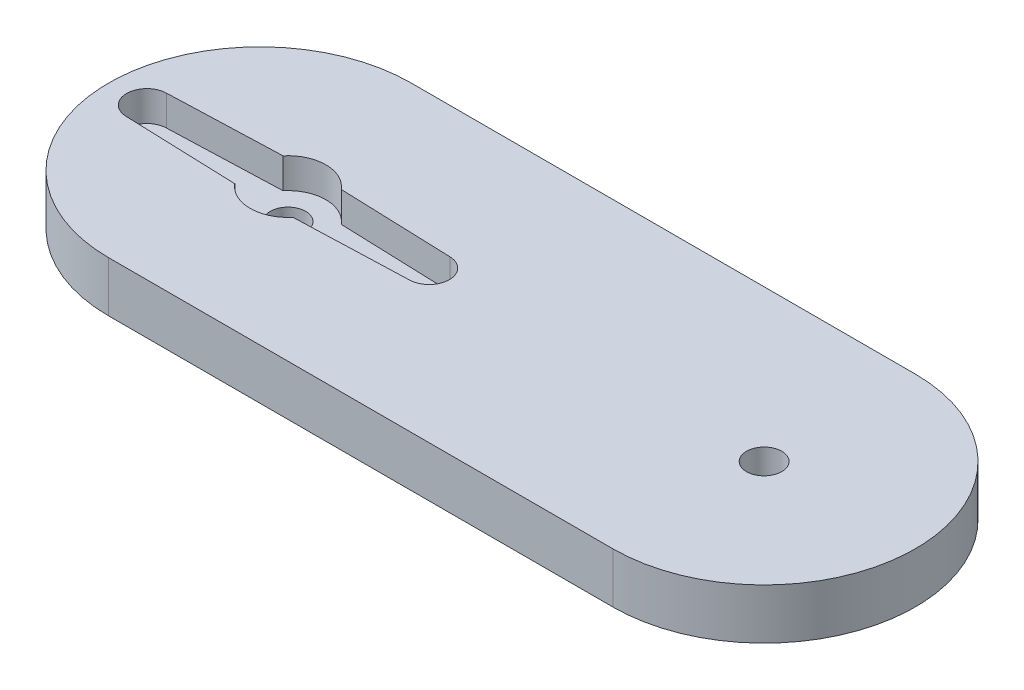
from build123d import *

# Parameters (mm, degrees)
RESSALTO_EXTRUS_O2_DEPTH = 5
ESBO_O4_R                = 1.75
CORTE_EXTRUS_O1_DEPTH    = 10
CORTE_EXTRUS_O2_DEPTH    = 3
ESBO_O7_R                = 2.5
CORTE_EXTRUS_O3_DEPTH    = 3
ESBO_O12_R               = 1.75
CORTE_EXTRUS_O5_DEPTH    = 10


with BuildPart() as part:
    # Esboço3 → Ressalto-extrusão2 (new body)
    with BuildSketch(Plane(origin=(0, 0, 0), x_dir=(1, 0, 0), z_dir=(0, 1, 0))):
        with BuildLine():
            Line((-50, 15), (0, 15))
            ThreePointArc((0, 15), (15, 0), (0, -15))
            Line((0, -15), (-50, -15))
            ThreePointArc((-50, -15), (-65, 0), (-50, 15))
        make_face()
    extrude(amount=RESSALTO_EXTRUS_O2_DEPTH)

    # Esboço4 → Corte-extrusão1 (cut)
    with BuildSketch(Plane(origin=(0, 5, 0), x_dir=(1, 0, 0), z_dir=(0, 1, 0))):
        with Locations(Location((0, 0, 0), (0, 0, 90))):
            Circle(ESBO_O4_R)
    extrude(amount=-CORTE_EXTRUS_O1_DEPTH, mode=Mode.SUBTRACT)

    # Esboço6 → Corte-extrusão2 (cut)
    with BuildSketch(Plane(origin=(0, 5, 0), x_dir=(1, 0, 0), z_dir=(0, 1, 0))):
        with BuildLine():
            Line((-50.096108497, 2.395111434), (-61.281465627, 1.998745461))
            ThreePointArc((-61.281465627, 1.998745461), (-63.210637787, 0), (-61.281465627, -1.998745461))
            Line((-61.281465627, -1.998745461), (-50.096108497, -2.395111434))
            ThreePointArc((-50.096108497, -2.395111434), (-47.210637787, -3.75), (-44.325167077, -2.395111434))
            Line((-44.325167077, -2.395111434), (-33.139809947, -1.998745461))
            ThreePointArc((-33.139809947, -1.998745461), (-31.210637787, 0), (-33.139809947, 1.998745461))
            Line((-33.139809947, 1.998745461), (-44.325167077, 2.395111434))
            ThreePointArc((-44.325167077, 2.395111434), (-47.210637787, 3.75), (-50.096108497, 2.395111434))
        make_face()
        with BuildLine():
            ThreePointArc((-47.443873787, 2.489096416), (-47.210637787, 2.5), (-46.977401787, 2.489096416))
            ThreePointArc((-46.977401787, 2.489096416), (-45.362247947, 1.683286963), (-44.710637787, 0))
            ThreePointArc((-44.710637787, 0), (-45.362247947, -1.683286963), (-46.977401787, -2.489096416))
            ThreePointArc((-46.977401787, -2.489096416), (-47.210637787, -2.5), (-47.443873787, -2.489096416))
            ThreePointArc((-47.443873787, -2.489096416), (-49.710637787, 0), (-47.443873787, 2.489096416))
        make_face(mode=Mode.SUBTRACT)
    extrude(amount=-CORTE_EXTRUS_O2_DEPTH, mode=Mode.SUBTRACT)

    # Esboço7 → Corte-extrusão3 (cut)
    with BuildSketch(Plane(origin=(0, 5, 0), x_dir=(1, 0, 0), z_dir=(0, 1, 0))):
        with Locations((-47.210637787, 0)):
            Circle(ESBO_O7_R)
    extrude(amount=-CORTE_EXTRUS_O3_DEPTH, mode=Mode.SUBTRACT)

    # Esboço12 → Corte-extrusão5 (cut)
    with BuildSketch(Plane(origin=(0, 2, 0), x_dir=(1, 0, 0), z_dir=(0, 1, 0))):
        with Locations(Location((-47.210637787, 0, 0), (0, 0, 270))):
            Circle(ESBO_O12_R)
    extrude(amount=-CORTE_EXTRUS_O5_DEPTH, mode=Mode.SUBTRACT)


solid = part.part
